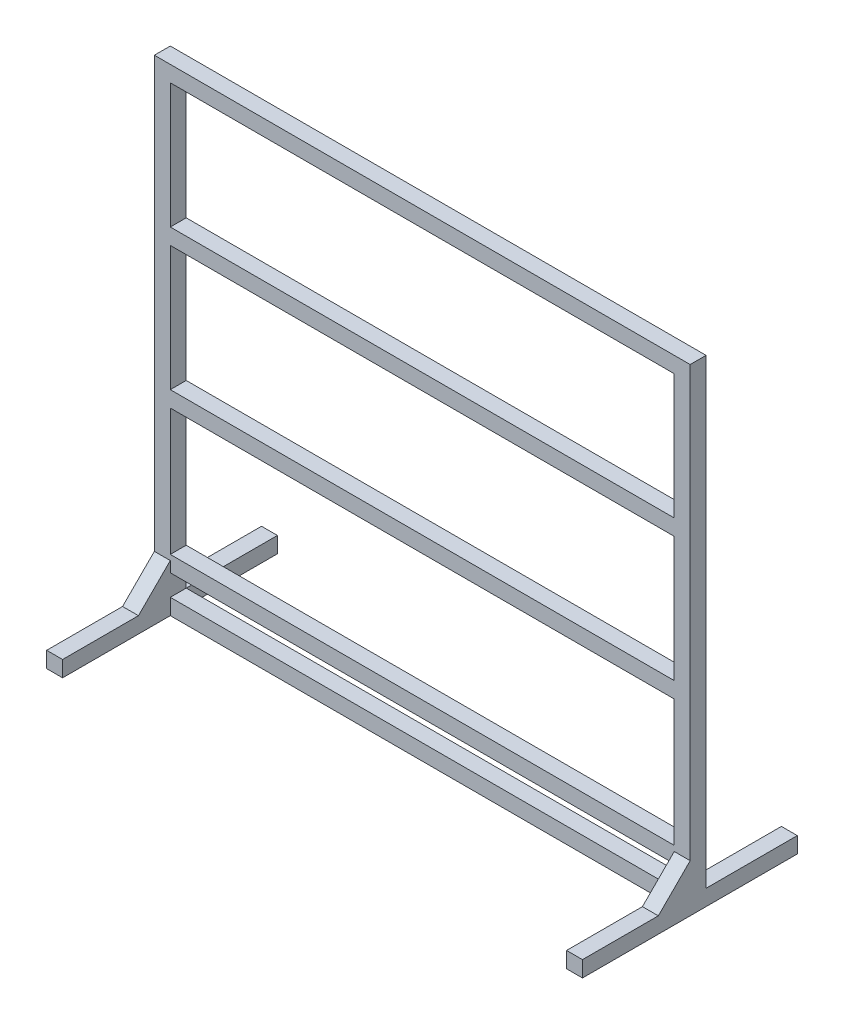
from build123d import *

# Parameters (mm, degrees)
SKETCH1_W           = 1010
SKETCH1_H           = 900
SKETCH1_W_2         = 950
SKETCH1_H_2         = 840
SKETCH1_H_3         = 30
BOSS_EXTRUDE1_DEPTH = 30
SKETCH2_W           = 30
SKETCH2_H           = 30
BOSS_EXTRUDE2_DEPTH = 203
SKETCH3_W           = 30
SKETCH3_H           = 30
BOSS_EXTRUDE3_DEPTH = 172
BOSS_EXTRUDE4_DEPTH = 30
BOSS_EXTRUDE5_DEPTH = 30


with BuildPart() as part:
    # Sketch1 → Boss-Extrude1 (new body)
    # profile 1 of 4: a face of its own
    with BuildSketch(Plane.XY):
        with Locations((505, -450)):
            Rectangle(SKETCH1_W, SKETCH1_H)
        with Locations((505, -450)):
            Rectangle(SKETCH1_W_2, SKETCH1_H_2, mode=Mode.SUBTRACT)
    # profile 2 of 4: a face of its own
    with BuildSketch(Plane.XY):
        with Locations((505, -815)):
            Rectangle(SKETCH1_W_2, SKETCH1_H_3)
    # profile 3 of 4: a face of its own
    with BuildSketch(Plane.XY):
        with Locations((505, -546)):
            Rectangle(SKETCH1_W_2, SKETCH1_H_3)
    # profile 4 of 4: a face of its own
    with BuildSketch(Plane.XY):
        with Locations((505, -280.5)):
            Rectangle(SKETCH1_W_2, SKETCH1_H_3)
    extrude(amount=BOSS_EXTRUDE1_DEPTH)

    # Sketch2 → Boss-Extrude2 (add)
    with BuildSketch(Plane.XY.offset(30)):
        with Locations((15, -885)):
            Rectangle(SKETCH2_W, SKETCH2_H)
        with Locations((995, -885)):
            Rectangle(SKETCH2_W, SKETCH2_H)
    extrude(amount=BOSS_EXTRUDE2_DEPTH)

    # Sketch3 → Boss-Extrude3 (add)
    with BuildSketch(Plane(origin=(0, 0, 0), x_dir=(-1, 0, 0), z_dir=(0, 0, -1))):
        with Locations((-15, -885)):
            Rectangle(SKETCH3_W, SKETCH3_H)
        with Locations((-995, -885)):
            Rectangle(SKETCH3_W, SKETCH3_H)
    extrude(amount=BOSS_EXTRUDE3_DEPTH)

    # Sketch4 → Boss-Extrude4 (add)
    with BuildSketch(Plane.ZY):
        Polygon((30, -810), (90, -870), (30, -870), align=None)
    extrude(amount=-BOSS_EXTRUDE4_DEPTH)

    # Sketch5 → Boss-Extrude5 (add)
    with BuildSketch(Plane(origin=(1010, 0, 0), x_dir=(0, 0, -1), z_dir=(1, 0, 0))):
        Polygon((-30, -810), (-30, -870), (-90, -870), align=None)
    extrude(amount=-BOSS_EXTRUDE5_DEPTH)


solid = part.part
